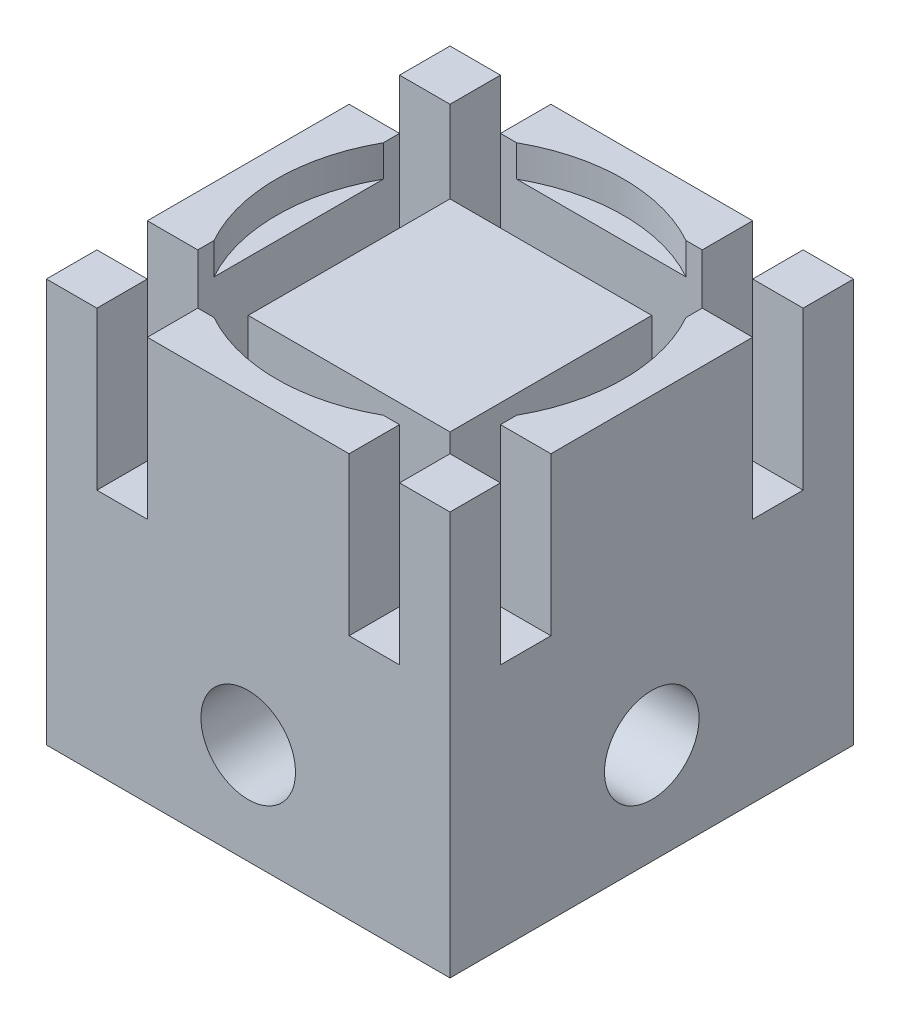
from build123d import *

# Parameters (mm, degrees)
SKETCH2_W           = 16.256
SKETCH2_H           = 16.256
BOSS_EXTRUDE1_DEPTH = 16.256
SKETCH3_R           = 6.985
CUT_EXTRUDE1_DEPTH  = 1.27
SKETCH4_W           = 2.032
SKETCH4_H           = 16.256
SKETCH4_W_2         = 16.256
SKETCH4_H_2         = 2.032
CUT_EXTRUDE3_DEPTH  = 6.35
SKETCH7_R           = 1.905
CUT_EXTRUDE5_DEPTH  = 23.172323288
SKETCH8_R           = 1.905
CUT_EXTRUDE6_DEPTH  = 27.26414042


with BuildPart() as part:
    # Sketch2 → Boss-Extrude1 (new body)
    with BuildSketch(Plane.XY):
        with Locations((0, 4.572)):
            Rectangle(SKETCH2_W, SKETCH2_H)
    extrude(amount=-BOSS_EXTRUDE1_DEPTH)

    # Sketch3 → Cut-Extrude1 (cut)
    with BuildSketch(Plane(origin=(0, 12.7, 0), x_dir=(1, 0, 0), z_dir=(0, 1, 0))):
        with Locations(Location((0, 8.128, 0), (0, 0, 270))):
            Circle(SKETCH3_R)
    extrude(amount=-CUT_EXTRUDE1_DEPTH, mode=Mode.SUBTRACT)

    # Sketch4 → Cut-Extrude3 (cut)
    with BuildSketch(Plane(origin=(0, 12.7, 0), x_dir=(1, 0, 0), z_dir=(0, 1, 0))):
        with Locations((-5.08, 8.128)):
            Rectangle(SKETCH4_W, SKETCH4_H)
        with Locations((5.08, 8.128)):
            Rectangle(SKETCH4_W, SKETCH4_H)
        with Locations((0, 13.208)):
            Rectangle(SKETCH4_W_2, SKETCH4_H_2)
        with Locations((0, 3.048)):
            Rectangle(SKETCH4_W_2, SKETCH4_H_2)
    extrude(amount=-CUT_EXTRUDE3_DEPTH, mode=Mode.SUBTRACT)

    # Sketch7 → Cut-Extrude5 (cut, through all)
    with BuildSketch(Plane.XY):
        with Locations((0, 0.508)):
            Circle(SKETCH7_R)
    extrude(amount=-CUT_EXTRUDE5_DEPTH, mode=Mode.SUBTRACT)

    # Sketch8 → Cut-Extrude6 (cut, through all)
    with BuildSketch(Plane(origin=(8.128, 0, 0), x_dir=(0, 0, -1), z_dir=(1, 0, 0))):
        with Locations(Location((8.128, 0.508, 0), (0, 0, 90))):
            Circle(SKETCH8_R)
    extrude(amount=-CUT_EXTRUDE6_DEPTH, mode=Mode.SUBTRACT)


solid = part.part
